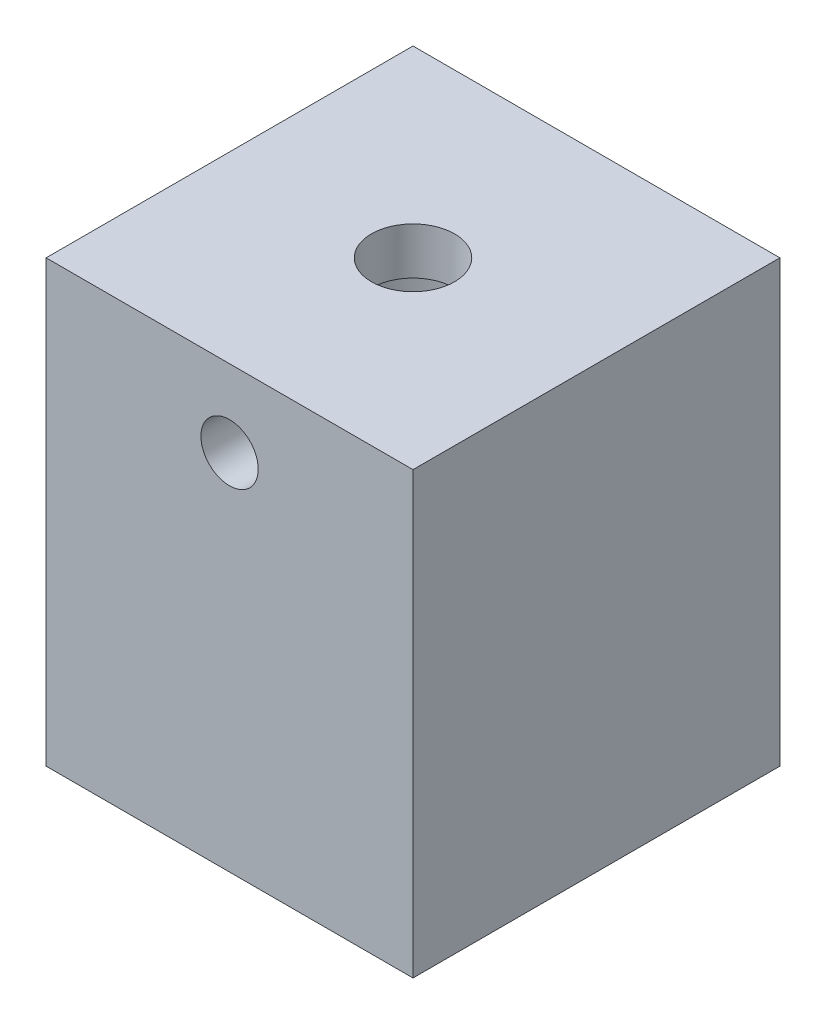
from build123d import *

# Parameters (mm, degrees)
SKETCH1_W                  = 50.8
SKETCH1_H                  = 50.8
BLOCK_DEPTH                = 60.96
SPRING_BORE_D              = 25.4
SPRING_BORE_DEPTH          = 50.292
SPRING_BORE_TIP            = 7.630929862
F_1_2_20_TAPPED_HOLE_D     = 11.50874
F_10_32_TAPPED_HOLES_D     = 4.0386
F_10_32_TAPPED_HOLES_DEPTH = 19.05
F_10_32_TAPPED_HOLES_TIP   = 1.213317848
VIEW_HOLE_D                = 7.9375


with BuildPart() as part:
    # Sketch1 → Block (new body)
    with BuildSketch(Plane(origin=(0, 0, 0), x_dir=(1, 0, 0), z_dir=(0, 1, 0))):
        Rectangle(SKETCH1_W, SKETCH1_H)
    extrude(amount=BLOCK_DEPTH)

    # Spring Bore
    with Locations(Plane(origin=(0, 0, 0), x_dir=(-1, 0, 0), z_dir=(0, -1, 0))):
        with Locations((0, 0)):
            Hole(SPRING_BORE_D / 2, depth=SPRING_BORE_DEPTH)
            with Locations((0, 0, -(SPRING_BORE_DEPTH + SPRING_BORE_TIP / 2))):  # 118° drill point
                Cone(0, SPRING_BORE_D / 2, SPRING_BORE_TIP, mode=Mode.SUBTRACT)

    # 1/2-20 Tapped Hole (through all)
    with Locations(Plane(origin=(0, 60.96, 0), x_dir=(1, 0, 0), z_dir=(0, 1, 0))):
        with Locations((0, 0)):
            Hole(F_1_2_20_TAPPED_HOLE_D / 2)

    # #10-32 Tapped Holes
    with Locations(Plane(origin=(0, 0, 0), x_dir=(-1, 0, 0), z_dir=(0, -1, 0))):
        with Locations((11.1125, 12.7), (11.1125, -12.7), (-11.1125, -12.7), (-11.1125, 12.7), (0, 0)):
            Hole(F_10_32_TAPPED_HOLES_D / 2, depth=F_10_32_TAPPED_HOLES_DEPTH)
            with Locations((0, 0, -(F_10_32_TAPPED_HOLES_DEPTH + F_10_32_TAPPED_HOLES_TIP / 2))):  # 118° drill point
                Cone(0, F_10_32_TAPPED_HOLES_D / 2, F_10_32_TAPPED_HOLES_TIP, mode=Mode.SUBTRACT)

    # View Hole (through all)
    with Locations(Plane.XY.offset(25.4)):
        with Locations((0, 50.292)):
            Hole(VIEW_HOLE_D / 2)


solid = part.part
